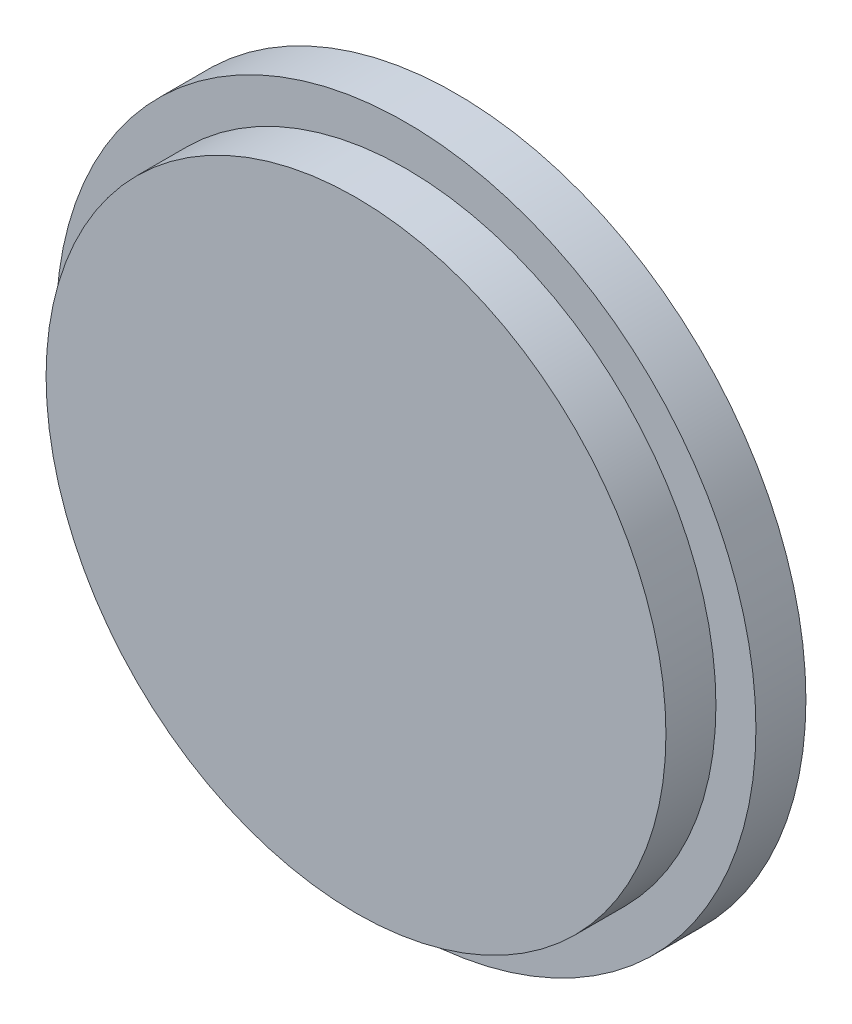
from build123d import *

# Parameters (mm, degrees)
SKETCH1_R           = 35
BOSS_EXTRUDE1_DEPTH = 5
SKETCH2_R           = 31
BOSS_EXTRUDE2_DEPTH = 5


with BuildPart() as part:
    # Sketch1 → Boss-Extrude1 (new body)
    with BuildSketch(Plane.XY):
        Circle(SKETCH1_R)
    extrude(amount=BOSS_EXTRUDE1_DEPTH)

    # Sketch2 → Boss-Extrude2 (add)
    with BuildSketch(Plane.XY.offset(5)):
        Circle(SKETCH2_R)
    extrude(amount=BOSS_EXTRUDE2_DEPTH)


solid = part.part
